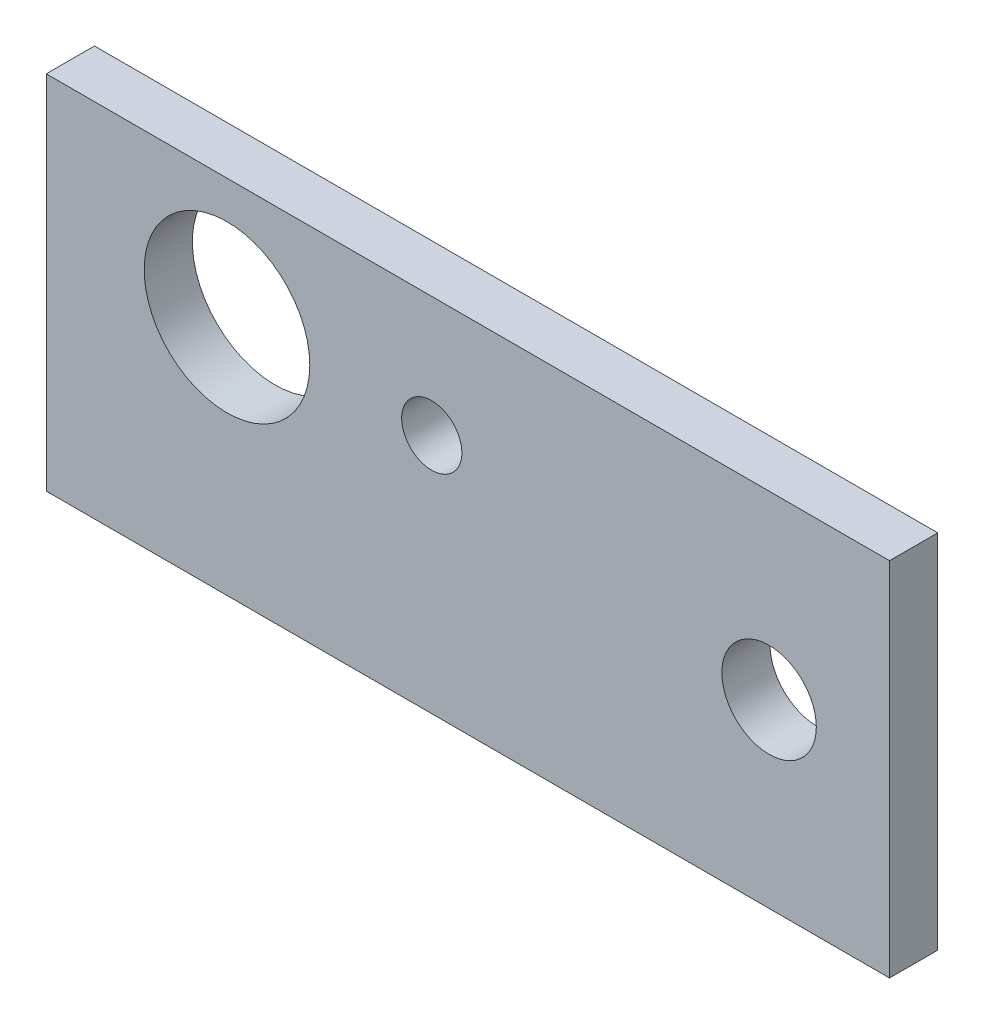
from build123d import *

# Parameters (mm, degrees)
SKETCH1_W           = 44.45
SKETCH1_H           = 19.05
BOSS_EXTRUDE1_DEPTH = 2.54
CUT_EXTRUDE1_REACH  = 26.313
SKETCH2_R           = 4.365625
SKETCH2_R_2         = 1.5875
SKETCH2_R_3         = 2.4892


with BuildPart() as part:
    # Sketch1 → Boss-Extrude1 (new body)
    with BuildSketch(Plane.XY):
        Rectangle(SKETCH1_W, SKETCH1_H)
    extrude(amount=BOSS_EXTRUDE1_DEPTH)

    # Sketch2 → Cut-Extrude1 (cut, up to next)
    with BuildSketch(Plane.XY.offset(2.54), mode=Mode.PRIVATE) as cut_extrude1_sk1:
        with Locations((-12.7, 3.175)):
            Circle(SKETCH2_R)
    cut_extrude1_tool1 = extrude(cut_extrude1_sk1.sketch, amount=-CUT_EXTRUDE1_REACH, mode=Mode.PRIVATE) & part.part
    # Sketch2 → Cut-Extrude1 (cut, up to next)
    with BuildSketch(Plane.XY.offset(2.54), mode=Mode.PRIVATE) as cut_extrude1_sk2:
        with Locations((-1.905, 3.175)):
            Circle(SKETCH2_R_2)
    cut_extrude1_tool2 = extrude(cut_extrude1_sk2.sketch, amount=-CUT_EXTRUDE1_REACH, mode=Mode.PRIVATE) & part.part
    # Sketch2 → Cut-Extrude1 (cut, up to next)
    with BuildSketch(Plane.XY.offset(2.54), mode=Mode.PRIVATE) as cut_extrude1_sk3:
        with Locations((15.875, 0)):
            Circle(SKETCH2_R_3)
    cut_extrude1_tool3 = extrude(cut_extrude1_sk3.sketch, amount=-CUT_EXTRUDE1_REACH, mode=Mode.PRIVATE) & part.part
    add(cut_extrude1_tool1.solids().sort_by_distance((-12.7, 3.175, 2.54))[0], mode=Mode.SUBTRACT)
    add(cut_extrude1_tool2.solids().sort_by_distance((-1.905, 3.175, 2.54))[0], mode=Mode.SUBTRACT)
    add(cut_extrude1_tool3.solids().sort_by_distance((15.875, 0, 2.54))[0], mode=Mode.SUBTRACT)


solid = part.part
